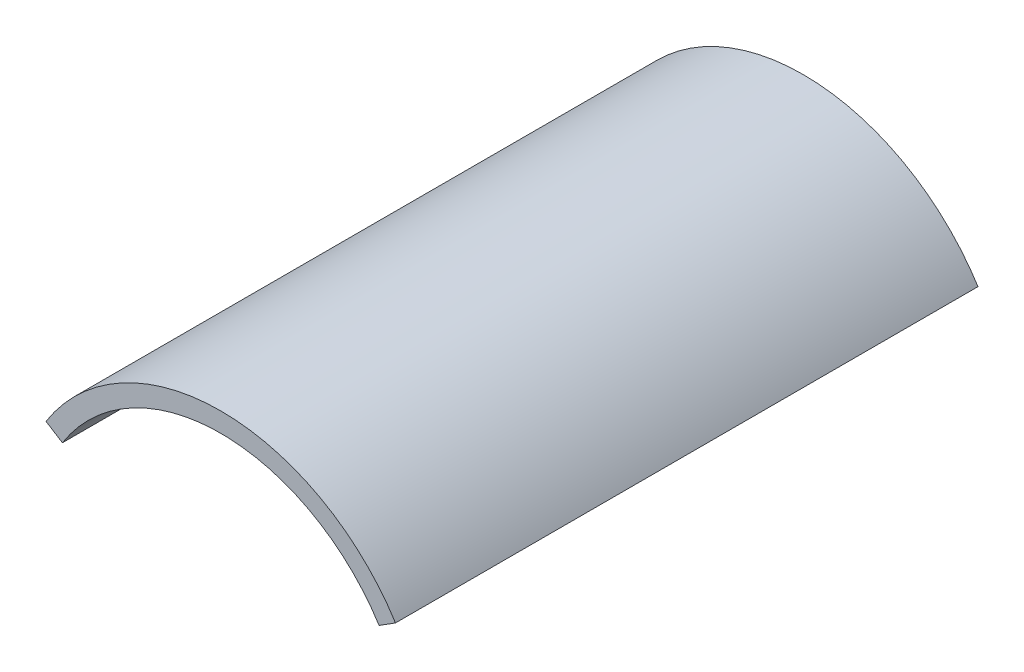
from build123d import *

# Parameters (mm, degrees)
EXTRUDE_THIN1_DEPTH = 150


with BuildPart() as part:
    # Sketch1 → Extrude-Thin1 (new body)
    with BuildSketch(Plane.XY):
        with BuildLine():
            ThreePointArc((-43.406229747, -0.432881311), (1.582918122, 24.405630192), (46.593770253, -0.393528465))
            Line((46.593770253, -0.393528465), (42.366014971, -3.06300131))
            ThreePointArc((42.366014971, -3.06300131), (1.585104391, 19.40563067), (-39.176141606, -3.098655932))
            Line((-39.176141606, -3.098655932), (-43.406229747, -0.432881311))
        make_face()
    extrude(amount=EXTRUDE_THIN1_DEPTH)


solid = part.part
